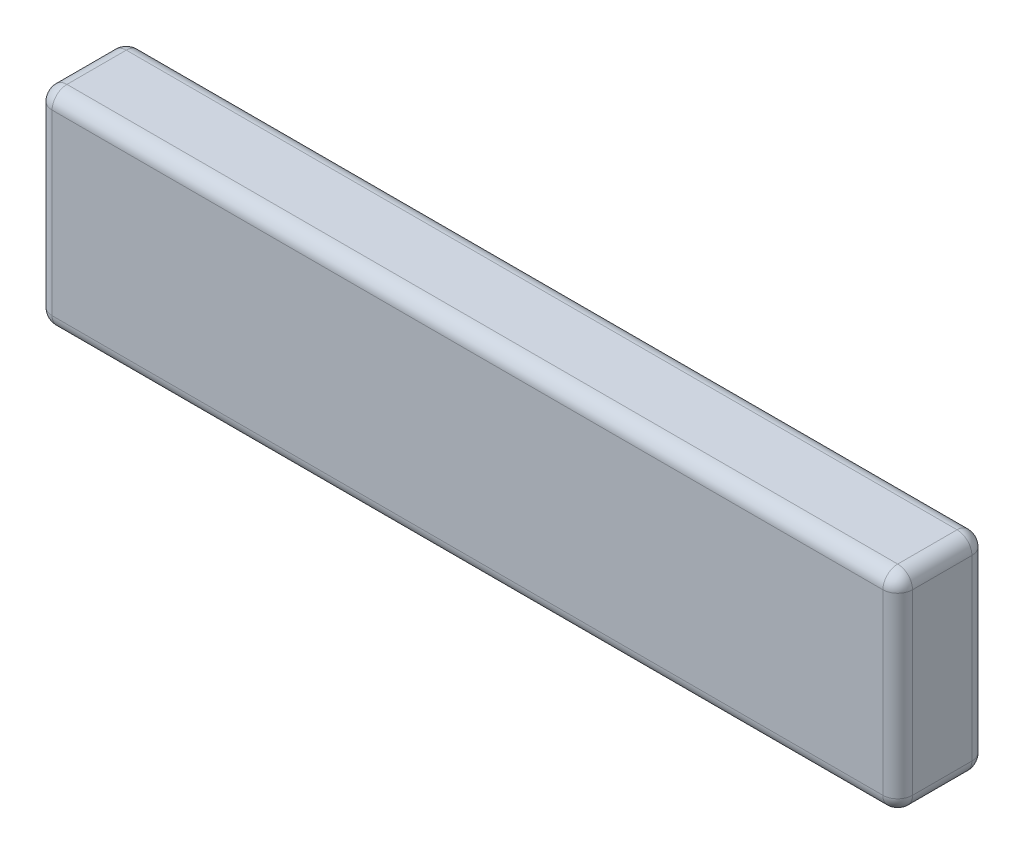
from build123d import *

# Parameters (mm, degrees)
BOSS_EXTRUDE1_START = 11.440071
SKETCH2_W           = 3
SKETCH2_H           = 7
BOSS_EXTRUDE1_DEPTH = 29
FILLET1_R           = 0.5
FILLET3_R           = 0.5


with BuildPart() as part:
    # Sketch2 → Boss-Extrude1 (new body)
    with BuildSketch(Plane(origin=(0, 0, 0), x_dir=(0, 0, -1), z_dir=(1, 0, 0)).offset(BOSS_EXTRUDE1_START)):
        with Locations((-38.793556796, 151.074028513)):
            Rectangle(SKETCH2_W, SKETCH2_H)
    extrude(amount=BOSS_EXTRUDE1_DEPTH)

    # Fillet1
    fillet1_edges = [part.edges().sort_by_distance(p)[0] for p in [
        (25.940071, 154.574028513, 40.293556796),
        (25.940071, 154.574028513, 37.293556796),
        (25.940071, 147.574028513, 37.293556796),
        (25.940071, 147.574028513, 40.293556796),
    ]]
    fillet(fillet1_edges, radius=FILLET1_R)

    # Fillet3
    fillet3_edges = [part.edges().sort_by_distance(p)[0] for p in [
        (40.440071, 154.574028513, 38.793556796),
        (11.440071, 154.574028513, 38.793556796),
        (11.440071, 151.074028513, 40.293556796),
        (11.440071, 151.074028513, 37.293556796),
        (11.440071, 147.574028513, 38.793556796),
        (11.440071, 147.720475122, 40.147110187),
        (11.440071, 147.720475122, 37.440003406),
        (11.440071, 154.427581903, 40.147110187),
        (11.440071, 154.427581903, 37.440003406),
        (40.440071, 151.074028513, 37.293556796),
        (40.440071, 147.574028513, 38.793556796),
        (40.440071, 151.074028513, 40.293556796),
        (40.440071, 147.720475122, 40.147110187),
        (40.440071, 147.720475122, 37.440003406),
        (40.440071, 154.427581903, 40.147110187),
        (40.440071, 154.427581903, 37.440003406),
    ]]
    fillet(fillet3_edges, radius=FILLET3_R)


solid = part.part
